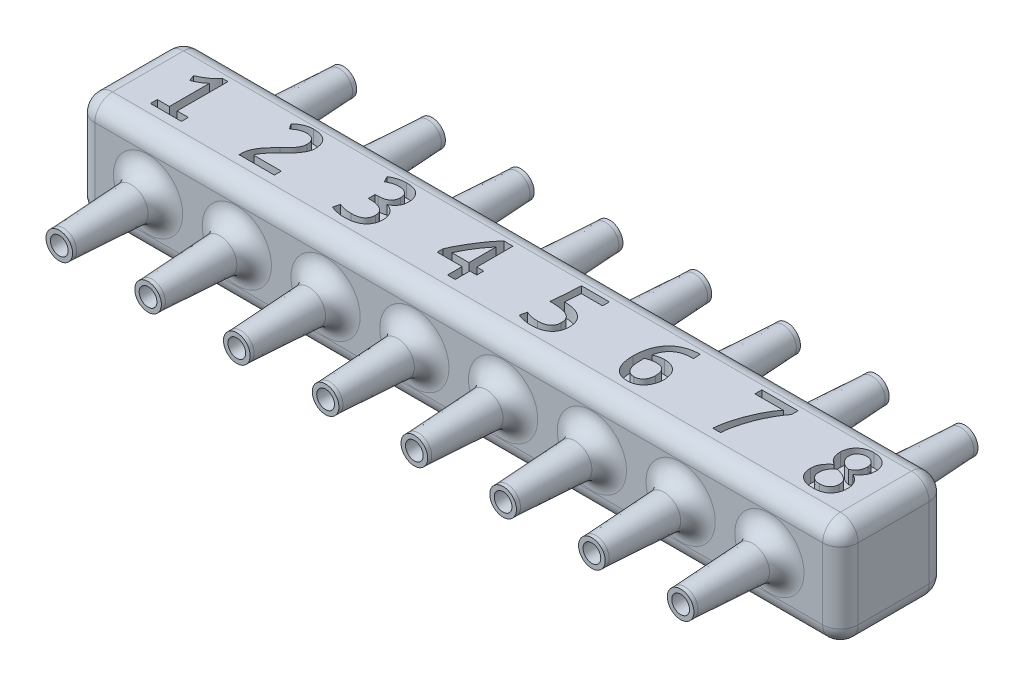
from build123d import *

# Parameters (mm, degrees)
SKETCH1_W           = 86
SKETCH1_H           = 12
BOSS_EXTRUDE1_DEPTH = 6
SKETCH2_R           = 1
CUT_EXTRUDE1_DEPTH  = 46.044422518
SKETCH3_R           = 2
SKETCH3_R_2         = 1
BOSS_EXTRUDE2_DEPTH = 10
BOSS_EXTRUDE2_TAPER = 3
BOSS_EXTRUDE3_START = 10
SKETCH4_R           = 1.5
SKETCH4_R_2         = 1
BOSS_EXTRUDE3_DEPTH = 10
FILLET1_R           = 2
FILLET2_R           = 2
CUT_EXTRUDE2_DEPTH  = 1.5


with BuildPart() as part:
    # Sketch1 → Boss-Extrude1 (new, symmetric)
    with BuildSketch(Plane(origin=(0, 0, 0), x_dir=(1, 0, 0), z_dir=(0, 1, 0))):
        Rectangle(SKETCH1_W, SKETCH1_H)
    extrude(amount=BOSS_EXTRUDE1_DEPTH, both=True)

    # Sketch2 → Cut-Extrude1 (cut, through all)
    with BuildSketch(Plane.XY.offset(6)):
        with Locations((-35, 0)):
            Circle(SKETCH2_R)
        with Locations((-25, 0)):
            Circle(SKETCH2_R)
        with Locations((-15, 0)):
            Circle(SKETCH2_R)
        with Locations((-5, 0)):
            Circle(SKETCH2_R)
        with Locations((5, 0)):
            Circle(SKETCH2_R)
        with Locations((15, 0)):
            Circle(SKETCH2_R)
        with Locations((25, 0)):
            Circle(SKETCH2_R)
        with Locations((35, 0)):
            Circle(SKETCH2_R)
    extrude(amount=-CUT_EXTRUDE1_DEPTH, mode=Mode.SUBTRACT)

    # Sketch3 → Boss-Extrude2 (add)
    # profile 1 of 8: a face of its own
    with BuildSketch(Plane.XY.offset(6)):
        with Locations((-35, 0)):
            Circle(SKETCH3_R)
        with Locations((-35, 0)):
            Circle(SKETCH3_R_2, mode=Mode.SUBTRACT)
    # profile 2 of 8: a face of its own
    with BuildSketch(Plane.XY.offset(6)):
        with Locations((-25, 0)):
            Circle(SKETCH3_R)
        with Locations((-25, 0)):
            Circle(SKETCH3_R_2, mode=Mode.SUBTRACT)
    # profile 3 of 8: a face of its own
    with BuildSketch(Plane.XY.offset(6)):
        with Locations((-15, 0)):
            Circle(SKETCH3_R)
        with Locations((-15, 0)):
            Circle(SKETCH3_R_2, mode=Mode.SUBTRACT)
    # profile 4 of 8: a face of its own
    with BuildSketch(Plane.XY.offset(6)):
        with Locations((-5, 0)):
            Circle(SKETCH3_R)
        with Locations((-5, 0)):
            Circle(SKETCH3_R_2, mode=Mode.SUBTRACT)
    # profile 5 of 8: a face of its own
    with BuildSketch(Plane.XY.offset(6)):
        with Locations((5, 0)):
            Circle(SKETCH3_R)
        with Locations((5, 0)):
            Circle(SKETCH3_R_2, mode=Mode.SUBTRACT)
    # profile 6 of 8: a face of its own
    with BuildSketch(Plane.XY.offset(6)):
        with Locations((15, 0)):
            Circle(SKETCH3_R)
        with Locations((15, 0)):
            Circle(SKETCH3_R_2, mode=Mode.SUBTRACT)
    # profile 7 of 8: a face of its own
    with BuildSketch(Plane.XY.offset(6)):
        with Locations((25, 0)):
            Circle(SKETCH3_R)
        with Locations((25, 0)):
            Circle(SKETCH3_R_2, mode=Mode.SUBTRACT)
    # profile 8 of 8: a face of its own
    with BuildSketch(Plane.XY.offset(6)):
        with Locations((35, 0)):
            Circle(SKETCH3_R)
        with Locations((35, 0)):
            Circle(SKETCH3_R_2, mode=Mode.SUBTRACT)
    boss_extrude2 = extrude(amount=BOSS_EXTRUDE2_DEPTH, taper=BOSS_EXTRUDE2_TAPER)

    # Sketch4 → Boss-Extrude3 (add)
    # profile 1 of 8: a face of its own
    with BuildSketch(Plane.XY.offset(6).offset(BOSS_EXTRUDE3_START)):
        with Locations((-35, 0)):
            Circle(SKETCH4_R)
        with Locations((-35, 0)):
            Circle(SKETCH4_R_2, mode=Mode.SUBTRACT)
    # profile 2 of 8: a face of its own
    with BuildSketch(Plane.XY.offset(6).offset(BOSS_EXTRUDE3_START)):
        with Locations((-25, 0)):
            Circle(SKETCH4_R)
        with Locations((-25, 0)):
            Circle(SKETCH4_R_2, mode=Mode.SUBTRACT)
    # profile 3 of 8: a face of its own
    with BuildSketch(Plane.XY.offset(6).offset(BOSS_EXTRUDE3_START)):
        with Locations((-15, 0)):
            Circle(SKETCH4_R)
        with Locations((-15, 0)):
            Circle(SKETCH4_R_2, mode=Mode.SUBTRACT)
    # profile 4 of 8: a face of its own
    with BuildSketch(Plane.XY.offset(6).offset(BOSS_EXTRUDE3_START)):
        with Locations((-5, 0)):
            Circle(SKETCH4_R)
        with Locations((-5, 0)):
            Circle(SKETCH4_R_2, mode=Mode.SUBTRACT)
    # profile 5 of 8: a face of its own
    with BuildSketch(Plane.XY.offset(6).offset(BOSS_EXTRUDE3_START)):
        with Locations((5, 0)):
            Circle(SKETCH4_R)
        with Locations((5, 0)):
            Circle(SKETCH4_R_2, mode=Mode.SUBTRACT)
    # profile 6 of 8: a face of its own
    with BuildSketch(Plane.XY.offset(6).offset(BOSS_EXTRUDE3_START)):
        with Locations((15, 0)):
            Circle(SKETCH4_R)
        with Locations((15, 0)):
            Circle(SKETCH4_R_2, mode=Mode.SUBTRACT)
    # profile 7 of 8: a face of its own
    with BuildSketch(Plane.XY.offset(6).offset(BOSS_EXTRUDE3_START)):
        with Locations((25, 0)):
            Circle(SKETCH4_R)
        with Locations((25, 0)):
            Circle(SKETCH4_R_2, mode=Mode.SUBTRACT)
    # profile 8 of 8: a face of its own
    with BuildSketch(Plane.XY.offset(6).offset(BOSS_EXTRUDE3_START)):
        with Locations((35, 0)):
            Circle(SKETCH4_R)
        with Locations((35, 0)):
            Circle(SKETCH4_R_2, mode=Mode.SUBTRACT)
    boss_extrude3 = extrude(amount=-BOSS_EXTRUDE3_DEPTH)

    # Mirror5: Boss-Extrude2, Boss-Extrude3 across plane
    add(boss_extrude2.mirror(Plane.XY))
    add(boss_extrude3.mirror(Plane.XY))

    # Fillet1
    fillet1_edges = [part.edges().sort_by_distance(p)[0] for p in [
        (-37, 0, -6),
        (-27, 0, -6),
        (-17, 0, -6),
        (-7, 0, -6),
        (3, 0, -6),
        (13, 0, -6),
        (23, 0, -6),
        (33, 0, -6),
        (33, 0, 6),
        (23, 0, 6),
        (13, 0, 6),
        (3, 0, 6),
        (-7, 0, 6),
        (-17, 0, 6),
        (-27, 0, 6),
        (-37, 0, 6),
    ]]
    fillet(fillet1_edges, radius=FILLET1_R)

    # Fillet2
    fillet2_edges = [part.edges().sort_by_distance(p)[0] for p in [
        (43, 6, 0),
        (0, 6, -6),
        (-43, 6, 0),
        (0, -6, -6),
        (43, -6, 0),
        (0, -6, 6),
        (-43, -6, 0),
        (-43, 0, -6),
        (43, 0, -6),
        (43, 0, 6),
        (-43, 0, 6),
        (0, 6, 6),
    ]]
    fillet(fillet2_edges, radius=FILLET2_R)

    # Sketch5 → Cut-Extrude2 (cut)
    # profile 1 of 8: a face of its own
    with BuildSketch(Plane(origin=(0, 6, 0), x_dir=(1, 0, 0), z_dir=(0, 1, 0))):
        with BuildLine():
            add(Edge.make_bspline(
                [(-38.024794805, 2.141791045), (-37.939041007, 2.178897537), (-37.767209179, 2.253250819), (-37.514486928, 2.379798597), (-37.266342434, 2.520907043), (-37.021086816, 2.675824134), (-36.780384419, 2.847152051), (-36.551885764, 3.045134172), (-36.329218758, 3.260665271), (-36.192929622, 3.419540631), (-36.123908611, 3.5)],
                knots=[0, 0, 0, 0, 0.949942144, 1.903475973, 2.872115686, 3.851325647, 4.852330339, 5.872688108, 6.922663822, 8, 8, 8, 8], degree=3))
            Line((-36.123908611, 3.5), (-35.502406745, 3.5))
            Line((-35.502406745, 3.5), (-35.502406745, -2.223880597))
            Line((-35.502406745, -2.223880597), (-34.241212716, -2.223880597))
            Line((-34.241212716, -2.223880597), (-34.241212716, -3))
            Line((-34.241212716, -3), (-37.733750029, -3))
            Line((-37.733750029, -3), (-37.733750029, -2.223880597))
            Line((-37.733750029, -2.223880597), (-36.375541074, -2.223880597))
            Line((-36.375541074, -2.223880597), (-36.375541074, 2.294892724))
            add(Edge.make_bspline(
                [(-36.375541074, 2.294892724), (-36.415367373, 2.256818507), (-36.499940746, 2.175965779), (-36.645453041, 2.063487737), (-36.807976558, 1.948648718), (-36.986074957, 1.837627133), (-37.175225253, 1.730912435), (-37.369379738, 1.628278559), (-37.565955042, 1.537393835), (-37.699080877, 1.487192637), (-37.764067193, 1.462686567)],
                knots=[0, 0, 0, 0, 0.81119089, 1.722609217, 2.70562663, 3.74241194, 4.812491782, 5.904559231, 6.977095789, 8, 8, 8, 8], degree=3))
            Line((-37.764067193, 1.462686567), (-38.024794805, 2.141791045))
        make_face()
    # profile 2 of 8: a face of its own
    with BuildSketch(Plane(origin=(0, 6, 0), x_dir=(1, 0, 0), z_dir=(0, 1, 0))):
        with BuildLine():
            add(Edge.make_bspline(
                [(-24.054645551, 1.885611007), (-24.056638894, 1.829951421), (-24.060607759, 1.719129794), (-24.085154408, 1.553824135), (-24.127860565, 1.391364014), (-24.208897871, 1.177045963), (-24.342719847, 0.912444151), (-24.546308598, 0.606688098), (-24.783723474, 0.305086243), (-25.050308823, 0.01156526), (-25.333413752, -0.277114993), (-25.526761227, -0.467290463), (-25.623558798, -0.5625)],
                knots=[0, 0, 0, 0, 0.559785175, 1.114566377, 1.676584211, 2.245746675, 3.416069934, 4.649270976, 5.934142595, 7.27270404, 8.634605268, 10, 10, 10, 10], degree=3))
            add(Edge.make_bspline(
                [(-25.623558798, -0.5625), (-25.682332535, -0.619939398), (-25.810100814, -0.744806954), (-26.007658354, -0.94502422), (-26.213539091, -1.164254946), (-26.413699087, -1.388402075), (-26.590999878, -1.61459247), (-26.716872399, -1.802217816), (-26.795020567, -1.947783124), (-26.836360898, -2.045930491), (-26.863427928, -2.137043884), (-26.866581575, -2.195931039), (-26.868078387, -2.223880597)],
                knots=[0, 0, 0, 0, 1.169291508, 2.541923824, 4.001658318, 5.448321494, 6.815993098, 8.088194522, 8.657430936, 9.16345543, 9.602951593, 10, 10, 10, 10], degree=3))
            Line((-26.868078387, -2.223880597), (-23.763600775, -2.223880597))
            Line((-23.763600775, -2.223880597), (-23.763600775, -3))
            Line((-23.763600775, -3), (-27.730601708, -3))
            add(Edge.make_bspline(
                [(-27.730601708, -3), (-27.733465904, -2.981847043), (-27.739250124, -2.945187291), (-27.741756851, -2.888854854), (-27.741087832, -2.833257778), (-27.741172244, -2.796370421), (-27.741212716, -2.778684701)],
                knots=[0, 0, 0, 0, 0.993051049, 2.005458736, 3.043713093, 4, 4, 4, 4], degree=3))
            add(Edge.make_bspline(
                [(-27.741212716, -2.778684701), (-27.739468157, -2.705846469), (-27.736027026, -2.562173503), (-27.708691682, -2.350814143), (-27.660952345, -2.148171067), (-27.596775898, -1.953221613), (-27.517655302, -1.765154568), (-27.425268916, -1.583926272), (-27.328090924, -1.40510511), (-27.178464799, -1.176828398), (-26.971909459, -0.902118895), (-26.696324749, -0.593211025), (-26.405899702, -0.300608465), (-26.21319715, -0.105748937), (-26.117728574, -0.009211754)],
                knots=[0, 0, 0, 0, 0.793417157, 1.565010456, 2.316809637, 3.058421752, 3.798643165, 4.537225103, 5.274040539, 6.014630332, 7.508705308, 9.014176964, 10.520765442, 12, 12, 12, 12], degree=3))
            add(Edge.make_bspline(
                [(-26.117728574, -0.009211754), (-26.04183629, 0.066987135), (-25.892314427, 0.217113068), (-25.673573662, 0.440155505), (-25.47056753, 0.660320488), (-25.290272514, 0.882194188), (-25.140263628, 1.109571118), (-25.041990428, 1.306937877), (-24.981841648, 1.467845392), (-24.95009147, 1.590193736), (-24.93123572, 1.714739114), (-24.928937456, 1.79813229), (-24.92777988, 1.840135261)],
                knots=[0, 0, 0, 0, 1.429358477, 2.816101103, 4.151905449, 5.408375982, 6.611656376, 7.764948643, 8.33010059, 8.892051424, 9.441955145, 10, 10, 10, 10], degree=3))
            add(Edge.make_bspline(
                [(-24.92777988, 1.840135261), (-24.928917439, 1.886181162), (-24.931100616, 1.974551329), (-24.948451081, 2.101854215), (-24.974223195, 2.218857576), (-25.015108539, 2.324997135), (-25.063778674, 2.421345998), (-25.117783982, 2.511442758), (-25.183807622, 2.589392554), (-25.279332646, 2.683595179), (-25.417892902, 2.78081408), (-25.607443713, 2.860148495), (-25.814462421, 2.910679476), (-25.958765278, 2.915457656), (-26.032840514, 2.917910448)],
                knots=[0, 0, 0, 0, 0.949029027, 1.821353306, 2.645231798, 3.413474809, 4.158985595, 4.870218613, 5.573238768, 6.258430331, 7.634347188, 9.029770458, 10.475286905, 12, 12, 12, 12], degree=3))
            add(Edge.make_bspline(
                [(-26.032840514, 2.917910448), (-26.119603481, 2.915416356), (-26.287318992, 2.9105952), (-26.524010736, 2.853958451), (-26.735666405, 2.778190662), (-26.92118631, 2.68771984), (-27.080456271, 2.589020997), (-27.21562717, 2.495824249), (-27.324064629, 2.412300086), (-27.384694179, 2.358812423), (-27.410755626, 2.335820896)],
                knots=[0, 0, 0, 0, 1.358016325, 2.625087741, 3.7957982, 4.880397871, 5.854944066, 6.732106892, 7.454999588, 8, 8, 8, 8], degree=3))
            Line((-27.410755626, 2.335820896), (-27.838227641, 2.93306903))
            add(Edge.make_bspline(
                [(-27.838227641, 2.93306903), (-27.82270862, 2.949383573), (-27.788956549, 2.984865814), (-27.731421655, 3.038563078), (-27.664406642, 3.098570854), (-27.556217974, 3.185083188), (-27.400741341, 3.297566569), (-27.182333991, 3.417814298), (-26.933476032, 3.52616103), (-26.705688134, 3.600461497), (-26.511072302, 3.649576537), (-26.356312316, 3.674070945), (-26.19698781, 3.692365789), (-26.088982633, 3.693470909), (-26.034356372, 3.694029851)],
                knots=[0, 0, 0, 0, 0.403388602, 0.877323457, 1.409668307, 2.014869743, 3.358932674, 4.842500564, 6.472457698, 8.216134259, 9.129652569, 10.065905415, 11.021784341, 12, 12, 12, 12], degree=3))
            add(Edge.make_bspline(
                [(-26.034356372, 3.694029851), (-25.952963263, 3.692505344), (-25.794942058, 3.689545581), (-25.566334381, 3.668811026), (-25.353889738, 3.632535891), (-25.157739499, 3.581678072), (-24.978145153, 3.514691057), (-24.814260571, 3.434692142), (-24.667862141, 3.338594148), (-24.537751731, 3.228433756), (-24.42313366, 3.104797536), (-24.324435809, 2.967541214), (-24.240662891, 2.817998082), (-24.172018539, 2.655867464), (-24.119346093, 2.480951424), (-24.081819622, 2.293674947), (-24.058633964, 2.09386577), (-24.056001588, 1.956416378), (-24.054645551, 1.885611007)],
                knots=[0, 0, 0, 0, 1.272483227, 2.470471183, 3.584793067, 4.638670875, 5.633545722, 6.576837751, 7.483941427, 8.363946654, 9.236008822, 10.11303049, 11.000802281, 11.910516529, 12.860138564, 13.851683224, 14.893320941, 16, 16, 16, 16], degree=3))
        make_face()
    # profile 3 of 8: a face of its own
    with BuildSketch(Plane(origin=(0, 6, 0), x_dir=(1, 0, 0), z_dir=(0, 1, 0))):
        with BuildLine():
            add(Edge.make_bspline(
                [(-15.721972977, -2.417910448), (-15.654239083, -2.417184917), (-15.5231346, -2.415780593), (-15.334198074, -2.400923074), (-15.160138286, -2.374774004), (-15.001083913, -2.341170872), (-14.85722066, -2.295779229), (-14.729360592, -2.239487973), (-14.615475562, -2.174692611), (-14.517475286, -2.09752466), (-14.432831959, -2.012378474), (-14.358622581, -1.92096856), (-14.298714961, -1.821067226), (-14.245868176, -1.71641566), (-14.206506299, -1.603241852), (-14.17993494, -1.483108682), (-14.162725462, -1.356795201), (-14.160339601, -1.270462758), (-14.159123163, -1.226445896)],
                knots=[0, 0, 0, 0, 1.449993148, 2.806580197, 4.053484485, 5.216320626, 6.283758534, 7.276731201, 8.202614294, 9.081217256, 9.937969724, 10.769207963, 11.594866174, 12.42701906, 13.275535972, 14.152071865, 15.057828134, 16, 16, 16, 16], degree=3))
            add(Edge.make_bspline(
                [(-14.159123163, -1.226445896), (-14.160545695, -1.170207983), (-14.163283385, -1.061976966), (-14.193257611, -0.907072801), (-14.239437865, -0.765441249), (-14.307232863, -0.638917766), (-14.390612133, -0.526256154), (-14.484633566, -0.423315623), (-14.593019985, -0.334248363), (-14.71231388, -0.25664866), (-14.841820619, -0.18959337), (-14.981902404, -0.134453911), (-15.130371842, -0.086300084), (-15.343494617, -0.041870706), (-15.623395499, -3.7401e-05), (-15.852146025, 0.004925965), (-15.969057865, 0.007462687)],
                knots=[0, 0, 0, 0, 0.954805898, 1.837543551, 2.671415278, 3.478308239, 4.265157076, 5.049235062, 5.842154994, 6.642622084, 7.464732236, 8.31646154, 9.199324549, 10.114197568, 12.014009765, 14, 14, 14, 14], degree=3))
            Line((-15.969057865, 0.007462687), (-16.196436596, 0.007462687))
            Line((-16.196436596, 0.007462687), (-16.196436596, 0.78358209))
            Line((-16.196436596, 0.78358209), (-15.881138089, 0.78358209))
            add(Edge.make_bspline(
                [(-15.881138089, 0.78358209), (-15.800169074, 0.786048064), (-15.634927362, 0.79108063), (-15.429079137, 0.82217506), (-15.264050931, 0.85850779), (-15.144989307, 0.898878917), (-15.03003951, 0.945039235), (-14.922167405, 1.003457103), (-14.819992923, 1.070511268), (-14.728936062, 1.151806693), (-14.647433148, 1.243523398), (-14.577664332, 1.347433519), (-14.517937992, 1.464021168), (-14.478662151, 1.596542199), (-14.453461469, 1.743166911), (-14.451300577, 1.84557579), (-14.450167939, 1.899253731)],
                knots=[0, 0, 0, 0, 1.652275272, 3.371966353, 4.240107132, 5.097893456, 5.934904317, 6.765472365, 7.597895434, 8.423582279, 9.249269125, 10.096009323, 10.972382, 11.911903981, 12.905517784, 14, 14, 14, 14], degree=3))
            add(Edge.make_bspline(
                [(-14.450167939, 1.899253731), (-14.451546704, 1.9437475), (-14.454202875, 2.029464122), (-14.468469181, 2.153675106), (-14.496455039, 2.267103057), (-14.531718248, 2.371836303), (-14.581326307, 2.465216669), (-14.640401948, 2.548789126), (-14.709726116, 2.623473214), (-14.817201792, 2.706761365), (-14.967237961, 2.790491517), (-15.160622358, 2.866551604), (-15.37001173, 2.908776635), (-15.513618162, 2.914819828), (-15.587061596, 2.917910448)],
                knots=[0, 0, 0, 0, 0.924174384, 1.780409002, 2.589588836, 3.346116368, 4.068788278, 4.776143855, 5.466410454, 6.175863514, 7.590341249, 9.01844834, 10.47517001, 12, 12, 12, 12], degree=3))
            add(Edge.make_bspline(
                [(-15.587061596, 2.917910448), (-15.661424086, 2.916742079), (-15.805018963, 2.914485946), (-16.011777932, 2.889194649), (-16.202326082, 2.851843996), (-16.373864492, 2.793589936), (-16.529429716, 2.729896462), (-16.670858658, 2.663774027), (-16.80036552, 2.599962526), (-16.879855305, 2.552579513), (-16.917985104, 2.529850746)],
                knots=[0, 0, 0, 0, 1.268834349, 2.450134642, 3.551531005, 4.577254971, 5.536819136, 6.420691996, 7.242434785, 8, 8, 8, 8], degree=3))
            Line((-16.917985104, 2.529850746), (-17.263600775, 3.190764925))
            add(Edge.make_bspline(
                [(-17.263600775, 3.190764925), (-17.221553611, 3.218208488), (-17.130647929, 3.277541281), (-16.974055814, 3.358750631), (-16.789281016, 3.440729131), (-16.579752365, 3.525893907), (-16.348672315, 3.601628654), (-16.10046392, 3.655947669), (-15.839553539, 3.688222314), (-15.661432045, 3.692065465), (-15.570387156, 3.694029851)],
                knots=[0, 0, 0, 0, 0.6724864, 1.45391099, 2.359999512, 3.380920169, 4.483633583, 5.613857477, 6.780348878, 8, 8, 8, 8], degree=3))
            add(Edge.make_bspline(
                [(-15.570387156, 3.694029851), (-15.485939031, 3.692818508), (-15.323232481, 3.690484608), (-15.088520561, 3.665880885), (-14.872177759, 3.625886678), (-14.674564884, 3.567830646), (-14.493390109, 3.496670581), (-14.33002306, 3.410268777), (-14.181985991, 3.311457033), (-14.053217573, 3.197110537), (-13.940924144, 3.0714027), (-13.840330912, 2.937926558), (-13.759361495, 2.791300325), (-13.691950494, 2.636032772), (-13.641269239, 2.471586261), (-13.602406153, 2.29997619), (-13.58174915, 2.120064884), (-13.578623862, 1.997830985), (-13.577033611, 1.935634328)],
                knots=[0, 0, 0, 0, 1.341771102, 2.58519592, 3.746023717, 4.833736964, 5.853795193, 6.8345262, 7.765598031, 8.675970175, 9.563018566, 10.441628947, 11.326201781, 12.218325276, 13.127634108, 14.057076645, 15.011376252, 16, 16, 16, 16], degree=3))
            add(Edge.make_bspline(
                [(-13.577033611, 1.935634328), (-13.579959615, 1.850461262), (-13.585639815, 1.685116327), (-13.637551048, 1.447634636), (-13.718636924, 1.228412918), (-13.837026635, 1.032849243), (-13.980912974, 0.860141792), (-14.142799523, 0.706846139), (-14.324102595, 0.574827437), (-14.457265801, 0.506025184), (-14.524444992, 0.471315299)],
                knots=[0, 0, 0, 0, 1.105107275, 2.145324767, 3.142528991, 4.128654032, 5.098522787, 6.055061531, 7.018802604, 8, 8, 8, 8], degree=3))
            add(Edge.make_bspline(
                [(-14.524444992, 0.471315299), (-14.442592013, 0.443413702), (-14.278621581, 0.387520355), (-14.049939019, 0.259547322), (-13.840164495, 0.095498764), (-13.680713316, -0.065415575), (-13.566007953, -0.210648478), (-13.490912714, -0.330607837), (-13.427479754, -0.459112051), (-13.375949284, -0.596902761), (-13.334918123, -0.742340553), (-13.306069504, -0.897048997), (-13.289746694, -1.060357462), (-13.287258341, -1.172344269), (-13.285988835, -1.229477612)],
                knots=[0, 0, 0, 0, 1.370299743, 2.745027036, 4.13408691, 5.585738423, 6.328444832, 7.067114173, 7.827405158, 8.598904968, 9.398603952, 10.222736815, 11.093277241, 12, 12, 12, 12], degree=3))
            add(Edge.make_bspline(
                [(-13.285988835, -1.229477612), (-13.28760135, -1.298809862), (-13.290768755, -1.434996736), (-13.319839801, -1.635190628), (-13.362351433, -1.828704209), (-13.426915963, -2.013100138), (-13.50640036, -2.189047072), (-13.607570579, -2.351907997), (-13.72662785, -2.502807901), (-13.863883663, -2.642379262), (-14.022519708, -2.766681358), (-14.202181195, -2.876676838), (-14.402981043, -2.97176849), (-14.625215762, -3.052163584), (-14.86889614, -3.115095598), (-15.133786171, -3.162398745), (-15.420777086, -3.189093484), (-15.619345241, -3.192347862), (-15.721972977, -3.194029851)],
                knots=[0, 0, 0, 0, 0.937036003, 1.840586496, 2.730731032, 3.612390027, 4.477637916, 5.336684785, 6.197903023, 7.072463434, 7.977433895, 8.916162558, 9.91559963, 10.976936545, 12.107277335, 13.314963991, 14.612269086, 16, 16, 16, 16], degree=3))
            add(Edge.make_bspline(
                [(-15.721972977, -3.194029851), (-15.804915757, -3.192244024), (-15.974258612, -3.188597932), (-16.227177212, -3.159720879), (-16.474666647, -3.12026069), (-16.706174857, -3.068775786), (-16.915477716, -3.00991795), (-17.075808409, -2.963287646), (-17.188143566, -2.926173419), (-17.256341541, -2.900969361), (-17.313244763, -2.88240544), (-17.346038092, -2.868318823), (-17.360615701, -2.862056903)],
                knots=[0, 0, 0, 0, 1.480119796, 3.021935249, 4.538778333, 5.952360145, 7.252016492, 8.419108622, 8.93248404, 9.363233961, 9.716938581, 10, 10, 10, 10], degree=3))
            Line((-17.360615701, -2.862056903), (-17.189323723, -2.126865672))
            add(Edge.make_bspline(
                [(-17.189323723, -2.126865672), (-17.156631244, -2.140897945), (-17.083539421, -2.172270433), (-16.958812392, -2.21452749), (-16.810074219, -2.263581814), (-16.636898251, -2.315240371), (-16.439855109, -2.36382189), (-16.218783922, -2.39267219), (-15.977631655, -2.415909182), (-15.80945588, -2.417225642), (-15.721972977, -2.417910448)],
                knots=[0, 0, 0, 0, 0.566381051, 1.26627974, 2.095856327, 3.060851758, 4.144114426, 5.323093988, 6.607507475, 8, 8, 8, 8], degree=3))
        make_face()
    # profile 4 of 8: a face of its own
    with BuildSketch(Plane(origin=(0, 6, 0), x_dir=(1, 0, 0), z_dir=(0, 1, 0))):
        with BuildLine():
            add(Edge.make_bspline(
                [(-7.077033611, -0.700443097), (-7.04774625, -0.628466026), (-6.986665259, -0.478352442), (-6.88046644, -0.248275158), (-6.763351577, -0.001353577), (-6.581285657, 0.352243051), (-6.327154344, 0.813020824), (-5.993012825, 1.376331866), (-5.629624134, 1.943410525), (-5.305340339, 2.407727297), (-5.039326749, 2.769810519), (-4.832876971, 3.024497462), (-4.631744149, 3.270688067), (-4.490702525, 3.42433857), (-4.421250029, 3.5)],
                knots=[0, 0, 0, 0, 0.5604733, 1.168909147, 1.827547192, 2.531757909, 4.037435729, 5.622693614, 7.255562756, 8.894591552, 9.707411772, 10.495805622, 11.259296288, 12, 12, 12, 12], degree=3))
            Line((-4.421250029, 3.5), (-3.390466447, 3.5))
            Line((-3.390466447, 3.5), (-3.390466447, -0.574626866))
            Line((-3.390466447, -0.574626866), (-2.614347044, -0.574626866))
            Line((-2.614347044, -0.574626866), (-2.614347044, -1.350746269))
            Line((-2.614347044, -1.350746269), (-3.390466447, -1.350746269))
            Line((-3.390466447, -1.350746269), (-3.390466447, -3))
            Line((-3.390466447, -3), (-4.263600775, -3))
            Line((-4.263600775, -3), (-4.263600775, -1.350746269))
            Line((-4.263600775, -1.350746269), (-7.077033611, -1.350746269))
            Line((-7.077033611, -1.350746269), (-7.077033611, -0.700443097))
        make_face()
        with BuildLine():
            add(Edge.make_bspline(
                [(-4.263600775, 2.472248134), (-4.352962315, 2.367914988), (-4.537473024, 2.152491407), (-4.80231063, 1.806772318), (-5.06671283, 1.438586444), (-5.323714527, 1.052491612), (-5.566389108, 0.651861785), (-5.793906251, 0.244884634), (-6.004218196, -0.162792641), (-6.127807977, -0.438631634), (-6.188740701, -0.574626866)],
                knots=[0, 0, 0, 0, 0.911263764, 1.881546859, 2.88816225, 3.918365697, 4.957854504, 5.994934947, 7.01145489, 8, 8, 8, 8], degree=3))
            Line((-6.188740701, -0.574626866), (-4.263600775, -0.574626866))
            Line((-4.263600775, -0.574626866), (-4.263600775, 2.472248134))
        make_face(mode=Mode.SUBTRACT)
    # profile 5 of 8: a face of its own
    with BuildSketch(Plane(origin=(0, 6, 0), x_dir=(1, 0, 0), z_dir=(0, 1, 0))):
        with BuildLine():
            add(Edge.make_bspline(
                [(4.952817135, 0.97761194), (5.067634602, 0.971982782), (5.289218048, 0.961119205), (5.608913423, 0.92192152), (5.904827538, 0.871223063), (6.176139185, 0.799047829), (6.423780189, 0.713246127), (6.648779697, 0.613033705), (6.84702702, 0.491597232), (7.023416201, 0.356795793), (7.174616948, 0.204913337), (7.308887362, 0.043931943), (7.419509784, -0.132024601), (7.510964005, -0.319551213), (7.582837486, -0.519165044), (7.632223908, -0.731843071), (7.663104408, -0.956223259), (7.667165658, -1.110128069), (7.669235046, -1.18854944)],
                knots=[0, 0, 0, 0, 1.404789017, 2.711068267, 3.934784396, 5.071929431, 6.13852582, 7.136373994, 8.075993264, 8.974197228, 9.843366603, 10.690394126, 11.531749803, 12.377063972, 13.236721883, 14.119156133, 15.041626091, 16, 16, 16, 16], degree=3))
            add(Edge.make_bspline(
                [(7.669235046, -1.18854944), (7.667474202, -1.259882024), (7.664015665, -1.399988899), (7.637069186, -1.60630723), (7.595783591, -1.805100618), (7.534450585, -1.994689287), (7.458341464, -2.174810055), (7.359881551, -2.341431109), (7.242783556, -2.495501147), (7.105084109, -2.635770231), (6.948256038, -2.761658578), (6.772141005, -2.873609299), (6.57513902, -2.968162505), (6.359456436, -3.050368275), (6.123674232, -3.11594487), (5.867146416, -3.159648466), (5.590700828, -3.189873278), (5.399073883, -3.192612764), (5.299948665, -3.194029851)],
                knots=[0, 0, 0, 0, 0.970107501, 1.905422784, 2.826253149, 3.728421352, 4.612068001, 5.480939434, 6.353961226, 7.238649991, 8.147939346, 9.084264471, 10.071104817, 11.11540608, 12.221112135, 13.394207751, 14.652069912, 16, 16, 16, 16], degree=3))
            add(Edge.make_bspline(
                [(5.299948665, -3.194029851), (5.215489053, -3.192329795), (5.047140365, -3.188941169), (4.798143131, -3.160297537), (4.558010069, -3.11841728), (4.331074663, -3.073213926), (4.124601064, -3.019891069), (3.968370236, -2.973482785), (3.858735026, -2.93776066), (3.79370474, -2.907851948), (3.737110497, -2.888013193), (3.705589601, -2.870026549), (3.691623105, -2.862056903)],
                knots=[0, 0, 0, 0, 1.532434398, 3.054516996, 4.542515461, 5.956116308, 7.252803272, 8.410483424, 8.915102003, 9.342581376, 9.708706439, 10, 10, 10, 10], degree=3))
            Line((3.691623105, -2.862056903), (3.861399225, -2.126865672))
            add(Edge.make_bspline(
                [(3.861399225, -2.126865672), (3.893603036, -2.140846446), (3.964822293, -2.171765157), (4.085326498, -2.214503495), (4.228021047, -2.263483483), (4.393576521, -2.315124442), (4.582918311, -2.364242482), (4.797569239, -2.39272414), (5.034169446, -2.41596945), (5.19983038, -2.417244742), (5.286305941, -2.417910448)],
                knots=[0, 0, 0, 0, 0.574623147, 1.270788522, 2.092222977, 3.04466973, 4.110051567, 5.289333598, 6.585023088, 8, 8, 8, 8], degree=3))
            add(Edge.make_bspline(
                [(5.286305941, -2.417910448), (5.354553906, -2.416715633), (5.48520413, -2.414428345), (5.672715136, -2.398059653), (5.842769728, -2.370088473), (5.996053564, -2.329091179), (6.132888024, -2.276717978), (6.25680146, -2.218782756), (6.365214812, -2.149201285), (6.46161485, -2.073922876), (6.543823389, -1.989650867), (6.613699403, -1.900006687), (6.672470181, -1.805232383), (6.732223166, -1.67078578), (6.78546525, -1.492011173), (6.792539704, -1.343596355), (6.796100717, -1.268889925)],
                knots=[0, 0, 0, 0, 1.334754032, 2.555181129, 3.67786097, 4.701522877, 5.652321607, 6.540778462, 7.371515811, 8.166384694, 8.928124579, 9.667482233, 10.386140859, 11.102621728, 12.541568901, 14, 14, 14, 14], degree=3))
            add(Edge.make_bspline(
                [(6.796100717, -1.268889925), (6.79468469, -1.211726477), (6.791928432, -1.100459387), (6.769334384, -0.938078658), (6.728870607, -0.78618269), (6.677237822, -0.641660219), (6.6033555, -0.507600733), (6.506717388, -0.385120433), (6.386170513, -0.275390386), (6.243138143, -0.175827638), (6.074304771, -0.088198136), (5.878880505, -0.010794263), (5.654664191, 0.052977433), (5.402093268, 0.107695649), (5.118390827, 0.148831046), (4.802372833, 0.180988659), (4.452270681, 0.198225764), (4.207537086, 0.200371538), (4.079682807, 0.201492537)],
                knots=[0, 0, 0, 0, 0.783023692, 1.524134225, 2.23941411, 2.933786276, 3.621640325, 4.326560867, 5.061404861, 5.846872834, 6.707733074, 7.661576367, 8.721848191, 9.897719222, 11.199838125, 12.647067243, 14.248353269, 16, 16, 16, 16], degree=3))
            add(Edge.make_bspline(
                [(4.079682807, 0.201492537), (4.099218489, 0.354499212), (4.136954267, 0.650052026), (4.178354762, 1.083485692), (4.213598322, 1.496337681), (4.242724589, 1.897045934), (4.265437043, 2.290731352), (4.282854728, 2.684466735), (4.301216867, 3.087194379), (4.314097024, 3.360037486), (4.320704262, 3.5)],
                knots=[0, 0, 0, 0, 1.118859551, 2.161226563, 3.158115303, 4.124622286, 5.075546207, 6.018574914, 6.983572507, 8, 8, 8, 8], degree=3))
            Line((4.320704262, 3.5), (7.475205195, 3.5))
            Line((7.475205195, 3.5), (7.475205195, 2.723880597))
            Line((7.475205195, 2.723880597), (5.087728516, 2.723880597))
            add(Edge.make_bspline(
                [(5.087728516, 2.723880597), (5.083569344, 2.668307116), (5.074157359, 2.542547286), (5.061738213, 2.337283887), (5.045220558, 2.103318746), (5.025782766, 1.855236504), (5.004988521, 1.605628113), (4.986463523, 1.402618045), (4.974226167, 1.250491111), (4.966961805, 1.148864025), (4.959097635, 1.059491522), (4.954794041, 1.003385085), (4.952817135, 0.97761194)],
                knots=[0, 0, 0, 0, 0.954514389, 2.160015248, 3.522109867, 4.971791476, 6.422170426, 7.812188535, 8.463353238, 9.036190025, 9.557262677, 10, 10, 10, 10], degree=3))
        make_face()
    # profile 6 of 8: a face of its own
    with BuildSketch(Plane(origin=(0, 6, 0), x_dir=(1, 0, 0), z_dir=(0, 1, 0))):
        with BuildLine():
            add(Edge.make_bspline(
                [(14.07222012, -0.442747201), (14.0745921, -0.288979307), (14.079208324, 0.010275811), (14.130510344, 0.445269923), (14.204563576, 0.854440377), (14.316670124, 1.235031573), (14.4556349, 1.587990867), (14.622066289, 1.911970248), (14.815897697, 2.20608404), (15.036932485, 2.469765524), (15.284023251, 2.704758103), (15.556520521, 2.910422065), (15.855211367, 3.085385146), (16.177461467, 3.232755418), (16.523760522, 3.349820003), (16.892849675, 3.431560652), (17.282728728, 3.486456821), (17.550417881, 3.495412463), (17.687541949, 3.5)],
                knots=[0, 0, 0, 0, 1.217503572, 2.369442444, 3.465371403, 4.507855713, 5.506852321, 6.466426693, 7.387875206, 8.29142265, 9.186113581, 10.083540276, 10.989708346, 11.922905876, 12.886179906, 13.879555296, 14.913799836, 16, 16, 16, 16], degree=3))
            Line((17.687541949, 3.5), (17.758787284, 2.723880597))
            add(Edge.make_bspline(
                [(17.758787284, 2.723880597), (17.670290867, 2.721485575), (17.497527632, 2.716809999), (17.244786282, 2.690745851), (17.003453108, 2.657746047), (16.774453813, 2.608103734), (16.556125189, 2.549874285), (16.352178359, 2.46895051), (16.158183163, 2.375999425), (15.977709033, 2.263123073), (15.809919303, 2.134373681), (15.657760502, 1.986836655), (15.517026907, 1.824657805), (15.392429469, 1.642169642), (15.281230545, 1.441421827), (15.185950751, 1.21858126), (15.102123959, 0.975628926), (15.060645396, 0.803692859), (15.039337658, 0.71536847)],
                knots=[0, 0, 0, 0, 1.14252945, 2.230452823, 3.278488819, 4.285417361, 5.254089137, 6.191753381, 7.113695907, 8.027850755, 8.934714309, 9.839016726, 10.759573427, 11.702329713, 12.686344286, 13.717680053, 14.827561204, 16, 16, 16, 16], degree=3))
            add(Edge.make_bspline(
                [(15.039337658, 0.71536847), (15.125114749, 0.751950214), (15.300672381, 0.82682107), (15.582966603, 0.908837), (15.885258971, 0.968564223), (16.095080045, 0.974557751), (16.202000904, 0.97761194)],
                knots=[0, 0, 0, 0, 0.931137475, 1.905733674, 2.932801408, 4, 4, 4, 4], degree=3))
            add(Edge.make_bspline(
                [(16.202000904, 0.97761194), (16.288002501, 0.975719731), (16.45406861, 0.972065941), (16.69288165, 0.940131995), (16.912123721, 0.887364481), (17.111609551, 0.813261902), (17.290197126, 0.719725028), (17.452599039, 0.615329658), (17.593184189, 0.492898704), (17.717500737, 0.359173974), (17.82218134, 0.211229804), (17.913751576, 0.053964043), (17.988345107, -0.1160641), (18.046127394, -0.295770808), (18.091705289, -0.481744524), (18.12286148, -0.67184613), (18.143837291, -0.864695235), (18.145840118, -0.994463791), (18.146846986, -1.059701493)],
                knots=[0, 0, 0, 0, 1.289386351, 2.48976045, 3.605430617, 4.665350191, 5.67199699, 6.624140331, 7.553791686, 8.460171483, 9.356099809, 10.265989349, 11.185485027, 12.13448677, 13.09393048, 14.054480901, 15.021941846, 16, 16, 16, 16], degree=3))
            add(Edge.make_bspline(
                [(18.146846986, -1.059701493), (18.145273222, -1.120397276), (18.142103379, -1.242649522), (18.1197017, -1.427003562), (18.085188752, -1.613543878), (18.035847878, -1.800356882), (17.969916412, -1.983377032), (17.892797648, -2.162134657), (17.793576535, -2.329742016), (17.684494875, -2.491666219), (17.556236107, -2.639948459), (17.413396165, -2.776867783), (17.250832122, -2.895937023), (17.074359924, -3.003498143), (16.877753647, -3.08900751), (16.663442056, -3.150944216), (16.430633009, -3.187589644), (16.269843457, -3.191837214), (16.186842322, -3.194029851)],
                knots=[0, 0, 0, 0, 0.897832751, 1.808396971, 2.743814873, 3.703035259, 4.662983596, 5.620104391, 6.577925561, 7.540054445, 8.504938282, 9.472626977, 10.460886426, 11.480100816, 12.52452625, 13.622222179, 14.772567901, 16, 16, 16, 16], degree=3))
            add(Edge.make_bspline(
                [(16.186842322, -3.194029851), (16.100842903, -3.191575336), (15.934232714, -3.186820104), (15.692070179, -3.153697642), (15.467558738, -3.095949402), (15.258196489, -3.017179017), (15.066918872, -2.913606045), (14.891277268, -2.787709943), (14.733592957, -2.638581608), (14.593045643, -2.467076718), (14.471641173, -2.274981312), (14.362092331, -2.066521161), (14.274469262, -1.837867773), (14.199694007, -1.593392491), (14.142071565, -1.330795558), (14.102678307, -1.050533474), (14.075348551, -0.75251926), (14.073282199, -0.547912522), (14.07222012, -0.442747201)],
                knots=[0, 0, 0, 0, 1.046893987, 2.028190519, 2.968126508, 3.86378277, 4.744528135, 5.608355368, 6.487380526, 7.378971761, 8.300387932, 9.249577888, 10.241097633, 11.276324168, 12.359877589, 13.509941239, 14.720140747, 16, 16, 16, 16], degree=3))
        make_face()
        with BuildLine():
            add(Edge.make_bspline(
                [(16.104985979, 0.201492537), (15.999630367, 0.199284388), (15.797292534, 0.195043587), (15.504461541, 0.142616627), (15.224219932, 0.065450212), (15.046635034, -0.011070646), (14.955965456, -0.050139925)],
                knots=[0, 0, 0, 0, 1.06491933, 2.045201646, 3.001937982, 4, 4, 4, 4], degree=3))
            add(Edge.make_bspline(
                [(14.955965456, -0.050139925), (14.953108102, -0.083468414), (14.9474434, -0.149542117), (14.944793942, -0.249210451), (14.945510476, -0.351794774), (14.945407944, -0.421524866), (14.945354449, -0.457905784)],
                knots=[0, 0, 0, 0, 0.983421013, 1.949631395, 2.930242467, 4, 4, 4, 4], degree=3))
            add(Edge.make_bspline(
                [(14.945354449, -0.457905784), (14.947743065, -0.586869522), (14.95239363, -0.837958106), (14.9883632, -1.145610195), (15.031880303, -1.37749388), (15.076230037, -1.538442853), (15.129327583, -1.689633334), (15.191732271, -1.830756083), (15.268426061, -1.959201432), (15.355866762, -2.074692454), (15.455951712, -2.176357035), (15.568356867, -2.264366882), (15.697803507, -2.332641391), (15.842499616, -2.383894362), (16.004411969, -2.4114545), (16.117523195, -2.415704546), (16.176231314, -2.417910448)],
                knots=[0, 0, 0, 0, 2.068370535, 4.027056262, 4.960256702, 5.851091901, 6.702282522, 7.529473463, 8.321894335, 9.096875118, 9.847783213, 10.604965688, 11.377441115, 12.185016538, 13.057969141, 14, 14, 14, 14], degree=3))
            add(Edge.make_bspline(
                [(16.176231314, -2.417910448), (16.22536414, -2.416719977), (16.320239561, -2.41442118), (16.455721117, -2.389444377), (16.579394445, -2.350754985), (16.689144151, -2.293227805), (16.787977839, -2.224342173), (16.877566072, -2.146757543), (16.958402025, -2.061513916), (17.029897527, -1.968502982), (17.092268513, -1.868653434), (17.143264567, -1.76196417), (17.186735459, -1.650162554), (17.228860494, -1.495627972), (17.265062647, -1.304374011), (17.27090802, -1.151325303), (17.273712658, -1.077891791)],
                knots=[0, 0, 0, 0, 1.061256062, 2.04928405, 2.968391234, 3.852880022, 4.716678146, 5.568787742, 6.411245585, 7.252639942, 8.101591356, 8.951877656, 9.806156096, 10.691656615, 12.412640794, 14, 14, 14, 14], degree=3))
            add(Edge.make_bspline(
                [(17.273712658, -1.077891791), (17.272919548, -1.027327903), (17.271377844, -0.929038075), (17.257232155, -0.78679293), (17.23625161, -0.65350762), (17.207129019, -0.529157127), (17.164831049, -0.414698408), (17.117189499, -0.308743024), (17.060844126, -0.211369326), (16.993458623, -0.124840991), (16.91766166, -0.04692232), (16.831722535, 0.020669718), (16.735274122, 0.077089968), (16.627977261, 0.122192556), (16.51130047, 0.158649985), (16.38432204, 0.184144097), (16.247855603, 0.199399038), (16.153534703, 0.200781142), (16.104985979, 0.201492537)],
                knots=[0, 0, 0, 0, 1.219519933, 2.370593131, 3.444741538, 4.473599716, 5.445266068, 6.383478285, 7.274078597, 8.151822738, 9.022427865, 9.8905547, 10.781155012, 11.709496064, 12.692640236, 13.72539043, 14.829216088, 16, 16, 16, 16], degree=3))
        make_face(mode=Mode.SUBTRACT)
    # profile 7 of 8: a face of its own
    with BuildSketch(Plane(origin=(0, 6, 0), x_dir=(1, 0, 0), z_dir=(0, 1, 0))):
        with BuildLine():
            add(Edge.make_bspline(
                [(25.61699624, -3), (25.627564095, -2.87399944), (25.649071552, -2.617565974), (25.711462349, -2.229689494), (25.787249883, -1.829583217), (25.887964411, -1.422524622), (26.00450611, -1.013059731), (26.131862424, -0.606653869), (26.269090578, -0.20632733), (26.419441014, 0.184994406), (26.577551194, 0.566647111), (26.746200793, 0.934083414), (26.920197442, 1.288676442), (27.10231012, 1.625913581), (27.288510316, 1.941063139), (27.473420967, 2.23055841), (27.656915982, 2.490600734), (27.786301467, 2.648277413), (27.848339523, 2.723880597)],
                knots=[0, 0, 0, 0, 0.975305975, 1.984920467, 3.029412156, 4.116876286, 5.219030164, 6.314037343, 7.402758786, 8.483808963, 9.548187632, 10.589764591, 11.602813551, 12.595422026, 13.546255345, 14.426595412, 15.245580275, 16, 16, 16, 16], degree=3))
            Line((27.848339523, 2.723880597), (24.646846986, 2.723880597))
            Line((24.646846986, 2.723880597), (24.646846986, 3.5))
            Line((24.646846986, 3.5), (28.721473852, 3.5))
            Line((28.721473852, 3.5), (28.721473852, 2.755713619))
            add(Edge.make_bspline(
                [(28.721473852, 2.755713619), (28.66767215, 2.690099112), (28.553929967, 2.551383474), (28.389808717, 2.319648379), (28.219421622, 2.056815786), (28.040962484, 1.766817347), (27.864443936, 1.450027739), (27.687432417, 1.113892299), (27.518891967, 0.756360628), (27.351834138, 0.382777815), (27.195198399, -0.007771392), (27.046806774, -0.411634385), (26.913938891, -0.830226579), (26.786681516, -1.257673478), (26.679905575, -1.692166423), (26.592814251, -2.127968033), (26.52834788, -2.563624503), (26.502844771, -2.854825824), (26.490130568, -3)],
                knots=[0, 0, 0, 0, 0.651103606, 1.376498201, 2.177875698, 3.055187184, 3.989381475, 4.960798328, 5.970397336, 7.022562902, 8.101379798, 9.199439048, 10.324105209, 11.47159558, 12.621965973, 13.75675706, 14.881663917, 16, 16, 16, 16], degree=3))
            Line((26.490130568, -3), (25.61699624, -3))
        make_face()
    # profile 8 of 8: a face of its own
    with BuildSketch(Plane(origin=(0, 6, 0), x_dir=(1, 0, 0), z_dir=(0, 1, 0))):
        with BuildLine():
            add(Edge.make_bspline(
                [(39.102070867, -1.323460821), (39.100849733, -1.391759701), (39.098462572, -1.52527528), (39.072914774, -1.720416466), (39.034614396, -1.905982529), (38.978043604, -2.081031371), (38.906232214, -2.245900399), (38.820070748, -2.401597433), (38.715640118, -2.546457709), (38.596410805, -2.681190801), (38.461195151, -2.803729645), (38.308378765, -2.908378141), (38.139399579, -2.99709751), (37.95429952, -3.069459393), (37.752026804, -3.125365388), (37.533989755, -3.165769046), (37.299270367, -3.190382019), (37.137580756, -3.192788216), (37.054146426, -3.194029851)],
                knots=[0, 0, 0, 0, 1.039063074, 2.031235466, 2.990669838, 3.91984512, 4.825777266, 5.724497505, 6.623086083, 7.538405704, 8.458849234, 9.393325697, 10.349795796, 11.358173302, 12.412580918, 13.539456383, 14.730321603, 16, 16, 16, 16], degree=3))
            add(Edge.make_bspline(
                [(37.054146426, -3.194029851), (36.95957407, -3.192040967), (36.778494495, -3.188232813), (36.519040379, -3.1582271), (36.28465004, -3.107590243), (36.074828773, -3.03604654), (35.888862233, -2.946977788), (35.722961197, -2.847402768), (35.576412881, -2.735620926), (35.450552807, -2.61139362), (35.344326444, -2.476147666), (35.252442435, -2.335810372), (35.179474905, -2.186741005), (35.121733538, -2.032307245), (35.080899284, -1.874374215), (35.049841983, -1.717023722), (35.03112357, -1.561400366), (35.028660027, -1.457914543), (35.027444001, -1.406833022)],
                knots=[0, 0, 0, 0, 1.483395224, 2.840286397, 4.090449168, 5.238584938, 6.30941078, 7.319510155, 8.269234735, 9.194120573, 10.085481208, 10.962808268, 11.820725278, 12.683572152, 13.54499774, 14.376733058, 15.198741031, 16, 16, 16, 16], degree=3))
            add(Edge.make_bspline(
                [(35.027444001, -1.406833022), (35.030879741, -1.315610569), (35.037602414, -1.137116628), (35.092237213, -0.877471969), (35.181767078, -0.634045961), (35.307942493, -0.410393624), (35.456745055, -0.20541948), (35.620046083, -0.019090404), (35.796376928, 0.147383997), (35.9257549, 0.240254135), (35.990013964, 0.286380597)],
                knots=[0, 0, 0, 0, 1.078632837, 2.110548642, 3.124571425, 4.136229322, 5.138514554, 6.117212877, 7.064862925, 8, 8, 8, 8], degree=3))
            add(Edge.make_bspline(
                [(35.990013964, 0.286380597), (35.921025413, 0.330611756), (35.786247579, 0.417022902), (35.609350636, 0.573785049), (35.458102586, 0.746225089), (35.337163936, 0.93778346), (35.238764396, 1.144681403), (35.17442046, 1.370708557), (35.131400791, 1.61263847), (35.126818848, 1.779805682), (35.124458926, 1.865904851)],
                knots=[0, 0, 0, 0, 1.038043132, 2.027948163, 2.986510637, 3.937588932, 4.892309112, 5.881799176, 6.909024506, 8, 8, 8, 8], degree=3))
            add(Edge.make_bspline(
                [(35.124458926, 1.865904851), (35.126427679, 1.926610035), (35.130315182, 2.046478569), (35.15471188, 2.224418065), (35.197700108, 2.397339556), (35.256225205, 2.565776493), (35.332818917, 2.725998007), (35.42129175, 2.878498045), (35.527270026, 3.018310405), (35.646034089, 3.148284665), (35.779153643, 3.266165592), (35.926781457, 3.371697397), (36.086926423, 3.465514801), (36.261089912, 3.545854595), (36.446589356, 3.613506432), (36.64512746, 3.659388003), (36.85362958, 3.689557142), (36.996433368, 3.692518628), (37.069305008, 3.694029851)],
                knots=[0, 0, 0, 0, 0.977319528, 1.929816365, 2.884672074, 3.84167345, 4.795003497, 5.739443109, 6.674872434, 7.613267795, 8.569785087, 9.531441921, 10.530323056, 11.552933891, 12.615525266, 13.702616578, 14.827663472, 16, 16, 16, 16], degree=3))
            add(Edge.make_bspline(
                [(37.069305008, 3.694029851), (37.153256948, 3.691834873), (37.315612857, 3.687589972), (37.549927433, 3.659588194), (37.765461517, 3.609667918), (37.961692117, 3.539565433), (38.139039519, 3.454096149), (38.299922709, 3.35904149), (38.441692858, 3.250440441), (38.566574657, 3.131902089), (38.674736058, 3.004196533), (38.765794044, 2.868458822), (38.842194192, 2.726900384), (38.902496762, 2.580362806), (38.947141349, 2.431693389), (38.98116966, 2.28448915), (39.001758242, 2.138337123), (39.003963571, 2.041301711), (39.005055941, 1.99323694)],
                knots=[0, 0, 0, 0, 1.393878922, 2.695643236, 3.910514866, 5.059495912, 6.147695887, 7.174978478, 8.156574748, 9.10602417, 10.028744343, 10.929228889, 11.815056336, 12.695304466, 13.555126424, 14.389566549, 15.202300335, 16, 16, 16, 16], degree=3))
            add(Edge.make_bspline(
                [(39.005055941, 1.99323694), (39.001837862, 1.902475186), (38.995572884, 1.725779617), (38.938824601, 1.471395877), (38.849885529, 1.234856709), (38.720435036, 1.022892921), (38.569456642, 0.832250105), (38.409149547, 0.657797448), (38.235914181, 0.505345484), (38.1115414, 0.418662633), (38.05006527, 0.375816231)],
                knots=[0, 0, 0, 0, 1.109194141, 2.1593863, 3.17324215, 4.187983652, 5.183577188, 6.146021124, 7.083598156, 8, 8, 8, 8], degree=3))
            add(Edge.make_bspline(
                [(38.05006527, 0.375816231), (38.133747919, 0.3304607), (38.296150248, 0.242439541), (38.511879242, 0.078289326), (38.694483367, -0.105348533), (38.846140287, -0.308418458), (38.959379257, -0.535085497), (39.044256198, -0.779255734), (39.092752687, -1.045168789), (39.098900559, -1.228778015), (39.102070867, -1.323460821)],
                knots=[0, 0, 0, 0, 1.077640651, 2.091369635, 3.059264913, 4.005430839, 4.950573536, 5.919552645, 6.92716397, 8, 8, 8, 8], degree=3))
        make_face()
        with BuildLine():
            add(Edge.make_bspline(
                [(35.900578329, -1.382579291), (35.904065244, -1.439352677), (35.911282757, -1.556867049), (35.953455852, -1.734509671), (36.032826694, -1.909654616), (36.129901964, -2.045170455), (36.227312766, -2.142707672), (36.313068397, -2.210346879), (36.410848279, -2.268058489), (36.51736875, -2.323312371), (36.637575428, -2.364236712), (36.769159442, -2.397207382), (36.913218773, -2.414500957), (37.013179505, -2.416749988), (37.064757434, -2.417910448)],
                knots=[0, 0, 0, 0, 1.168585115, 2.418836624, 3.730469708, 5.100461619, 5.820621932, 6.560751456, 7.339631036, 8.152969204, 9.024015565, 9.944026586, 10.939154922, 12, 12, 12, 12], degree=3))
            add(Edge.make_bspline(
                [(37.064757434, -2.417910448), (37.113822935, -2.416743561), (37.208211328, -2.414498796), (37.344671058, -2.397436242), (37.470626613, -2.370580623), (37.586876429, -2.33317991), (37.69129633, -2.283335799), (37.788290319, -2.229355087), (37.87480732, -2.165599859), (37.974925023, -2.070724561), (38.079985417, -1.938066849), (38.165185331, -1.758627517), (38.219171207, -1.572142532), (38.225717245, -1.445071759), (38.228936538, -1.382579291)],
                knots=[0, 0, 0, 0, 1.009335151, 1.94168038, 2.824664076, 3.656463533, 4.447226642, 5.201613139, 5.937724586, 6.651167228, 8.036268932, 9.389356123, 10.716104607, 12, 12, 12, 12], degree=3))
            add(Edge.make_bspline(
                [(38.228936538, -1.382579291), (38.22792019, -1.335017641), (38.225932222, -1.241987508), (38.206102896, -1.106640614), (38.172185634, -0.979846031), (38.127382319, -0.860672182), (38.067446262, -0.751101869), (37.995889839, -0.649711429), (37.90970404, -0.558011768), (37.81035721, -0.475298619), (37.701204244, -0.397984753), (37.58143424, -0.326900027), (37.453142781, -0.258047051), (37.313227846, -0.196831443), (37.164560341, -0.139100229), (37.006236297, -0.086021408), (36.837846201, -0.037344661), (36.721290115, -0.009726911), (36.66153915, 0.00443097)],
                knots=[0, 0, 0, 0, 0.995829475, 1.947832953, 2.856670773, 3.741208558, 4.607898317, 5.465492131, 6.334183113, 7.23540821, 8.169293603, 9.133167251, 10.151137629, 11.217218866, 12.329734459, 13.491171178, 14.713881457, 16, 16, 16, 16], degree=3))
            add(Edge.make_bspline(
                [(36.66153915, 0.00443097), (36.603413442, -0.034624837), (36.489398921, -0.111233439), (36.337931722, -0.248233722), (36.207119302, -0.399188732), (36.094620206, -0.56326746), (36.007388974, -0.744687045), (35.945385605, -0.942704843), (35.906656485, -1.157228981), (35.902640811, -1.306111869), (35.900578329, -1.382579291)],
                knots=[0, 0, 0, 0, 1.012552547, 1.986138295, 2.945194783, 3.898545879, 4.856932907, 5.846862441, 6.894131609, 8, 8, 8, 8], degree=3))
        make_face(mode=Mode.SUBTRACT)
        with BuildLine():
            add(Edge.make_bspline(
                [(38.131921613, 1.964435634), (38.128525192, 2.012711982), (38.121211869, 2.116662756), (38.073233312, 2.274946228), (37.999427027, 2.437135717), (37.885095814, 2.586801756), (37.73666561, 2.719526864), (37.584786156, 2.808708278), (37.44537185, 2.864648989), (37.328087926, 2.896824789), (37.199711456, 2.914626007), (37.11079249, 2.916790071), (37.064757434, 2.917910448)],
                knots=[0, 0, 0, 0, 0.911306283, 1.962265133, 3.101685074, 4.259841455, 5.489427396, 6.84087737, 7.560119242, 8.321527607, 9.131022617, 10, 10, 10, 10], degree=3))
            add(Edge.make_bspline(
                [(37.064757434, 2.917910448), (37.017723932, 2.916669992), (36.927384388, 2.914287388), (36.797031441, 2.898299801), (36.678997868, 2.868214816), (36.541064714, 2.813679406), (36.390034499, 2.72714919), (36.239722985, 2.597834794), (36.12405574, 2.44838966), (36.049700371, 2.283581077), (36.005586911, 2.113789467), (36.00023321, 1.999547363), (35.997593255, 1.943213619)],
                knots=[0, 0, 0, 0, 0.871248511, 1.673449563, 2.427116161, 3.120612124, 4.416199927, 5.630390678, 6.77230149, 7.886213083, 8.957673862, 10, 10, 10, 10], degree=3))
            add(Edge.make_bspline(
                [(35.997593255, 1.943213619), (36.000784526, 1.873059892), (36.007162491, 1.732853052), (36.068914736, 1.528311785), (36.164544854, 1.331378727), (36.273696313, 1.176180365), (36.380094909, 1.058347787), (36.475429607, 0.976404245), (36.582038651, 0.90042423), (36.700872694, 0.83075303), (36.831720986, 0.767170171), (36.975078494, 0.709576657), (37.130415502, 0.65800384), (37.239385441, 0.630775868), (37.295167881, 0.616837687)],
                knots=[0, 0, 0, 0, 1.251085955, 2.500377582, 3.784920935, 5.153016152, 5.875387429, 6.617971521, 7.394912724, 8.212773198, 9.077183691, 9.992916662, 10.972560609, 12, 12, 12, 12], degree=3))
            add(Edge.make_bspline(
                [(37.295167881, 0.616837687), (37.356703894, 0.654950364), (37.477262739, 0.729619167), (37.639120018, 0.861298584), (37.78305737, 1.001146123), (37.908828183, 1.152558527), (38.011634307, 1.322874967), (38.082265237, 1.517313424), (38.12536086, 1.7336415), (38.129674753, 1.885395614), (38.131921613, 1.964435634)],
                knots=[0, 0, 0, 0, 1.037611242, 2.03284559, 2.986410665, 3.913764515, 4.850002483, 5.824961907, 6.867147319, 8, 8, 8, 8], degree=3))
        make_face(mode=Mode.SUBTRACT)
    extrude(amount=-CUT_EXTRUDE2_DEPTH, mode=Mode.SUBTRACT)


solid = part.part
